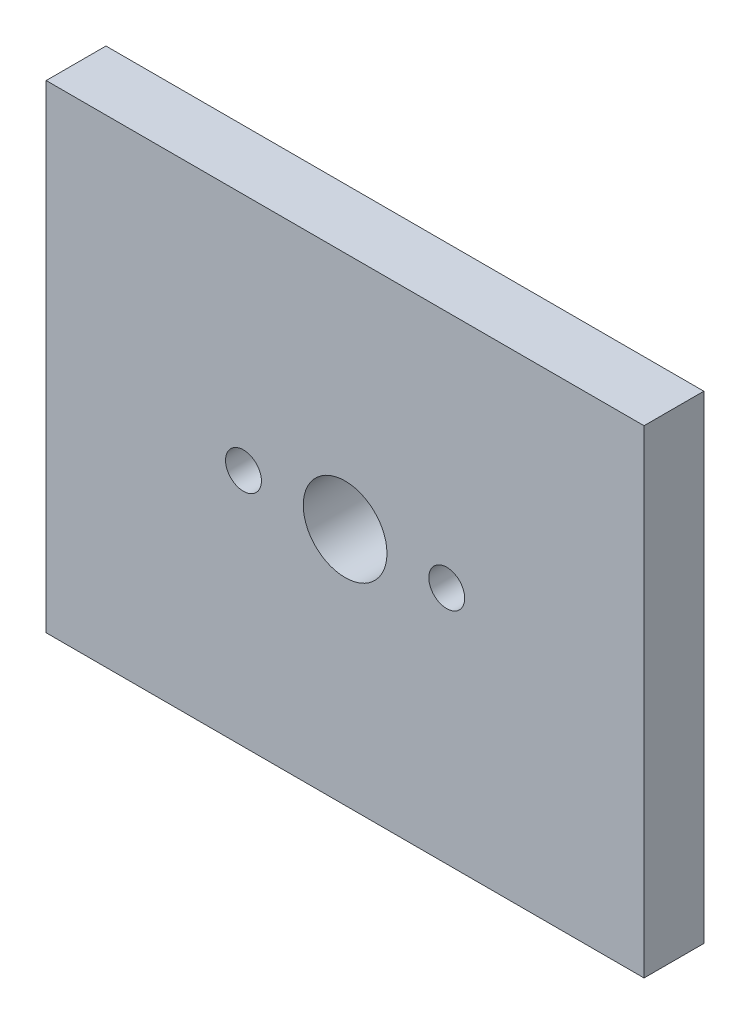
from build123d import *

# Parameters (mm, degrees)
ESQUISSE1_W             = 50
ESQUISSE1_H             = 40
BOSS_EXTRU_1_DEPTH      = 5
ESQUISSE2_R             = 1.5
ESQUISSE2_R_2           = 3.5
ENL_V_MAT_EXTRU_1_DEPTH = 10


with BuildPart() as part:
    # Esquisse1 → Boss.-Extru.1 (new body)
    with BuildSketch(Plane.XY):
        Rectangle(ESQUISSE1_W, ESQUISSE1_H)
    extrude(amount=BOSS_EXTRU_1_DEPTH)

    # Esquisse2 → Enlèv. mat.-Extru.1 (cut)
    with BuildSketch(Plane(origin=(0, 0, 0), x_dir=(-1, 0, 0), z_dir=(0, 0, -1))):
        with Locations((-8.5, 0)):
            Circle(ESQUISSE2_R)
        with Locations((8.5, 0)):
            Circle(ESQUISSE2_R)
        Circle(ESQUISSE2_R_2)
    extrude(amount=-ENL_V_MAT_EXTRU_1_DEPTH, mode=Mode.SUBTRACT)


solid = part.part
